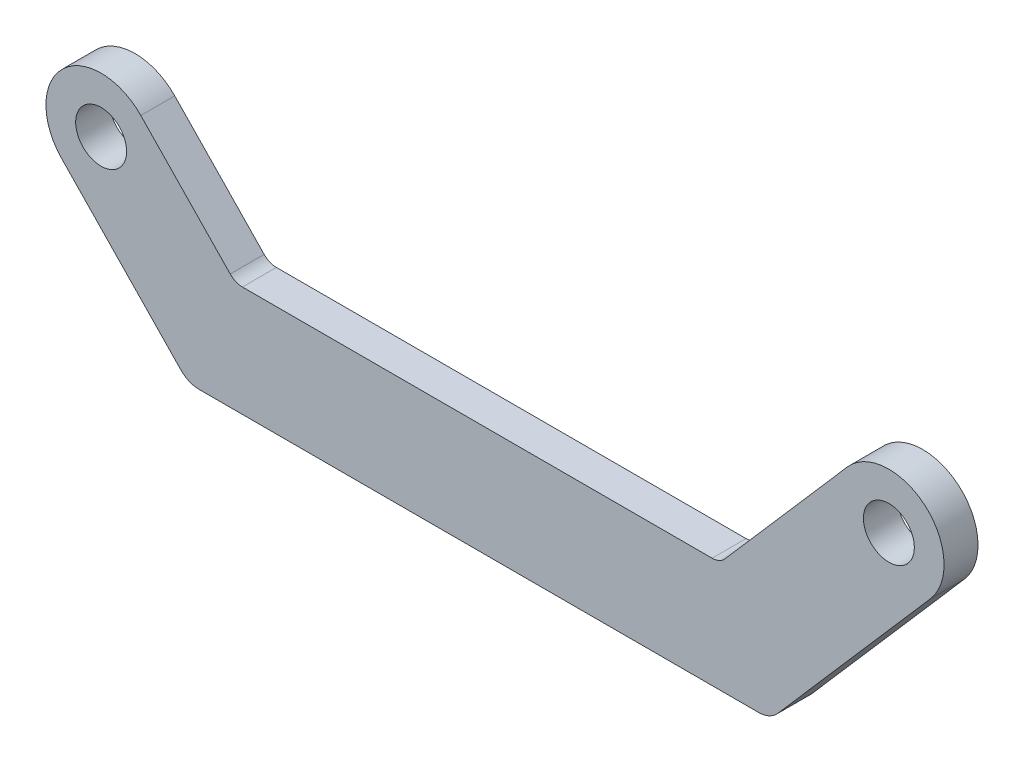
from build123d import *

# Parameters (mm, degrees)
ESQUISSE1_R          = 3
BASE_EXTRUSION_DEPTH = 4
CONG_1_R             = 3
CONG_2_R             = 2


with BuildPart() as part:
    # Esquisse1 → Base-Extrusion (new body)
    with BuildSketch(Plane.XY):
        with BuildLine():
            Line((15.795884765, -7), (72.892937741, -7))
            Line((72.892937741, -7), (87.900637518, 10.264383688))
            ThreePointArc((87.900637518, 10.264383688), (97.070633478, 10.905612271), (97.711862061, 1.735616312))
            Line((97.711862061, 1.735616312), (78.817379063, -20))
            Line((78.817379063, -20), (10.277712155, -20))
            Line((10.277712155, -20), (-4.675708702, -4.515279408))
            ThreePointArc((-4.675708702, -4.515279408), (-4.515279408, 4.675708702), (4.675708702, 4.515279408))
            Line((4.675708702, 4.515279408), (15.795884765, -7))
        make_face()
        Circle(ESQUISSE1_R, mode=Mode.SUBTRACT)
        with Locations((92.80624979, 6)):
            Circle(ESQUISSE1_R, mode=Mode.SUBTRACT)
    extrude(amount=BASE_EXTRUSION_DEPTH)

    # Congé1
    cong_1_edges = [part.edges().sort_by_distance(p)[0] for p in [
        (78.817379063, -20, 2),
        (10.277712155, -20, 2),
    ]]
    fillet(cong_1_edges, radius=CONG_1_R)

    # Congé2
    cong_2_edges = [part.edges().sort_by_distance(p)[0] for p in [
        (72.892937741, -7, 2),
        (15.795884765, -7, 2),
    ]]
    fillet(cong_2_edges, radius=CONG_2_R)


solid = part.part
